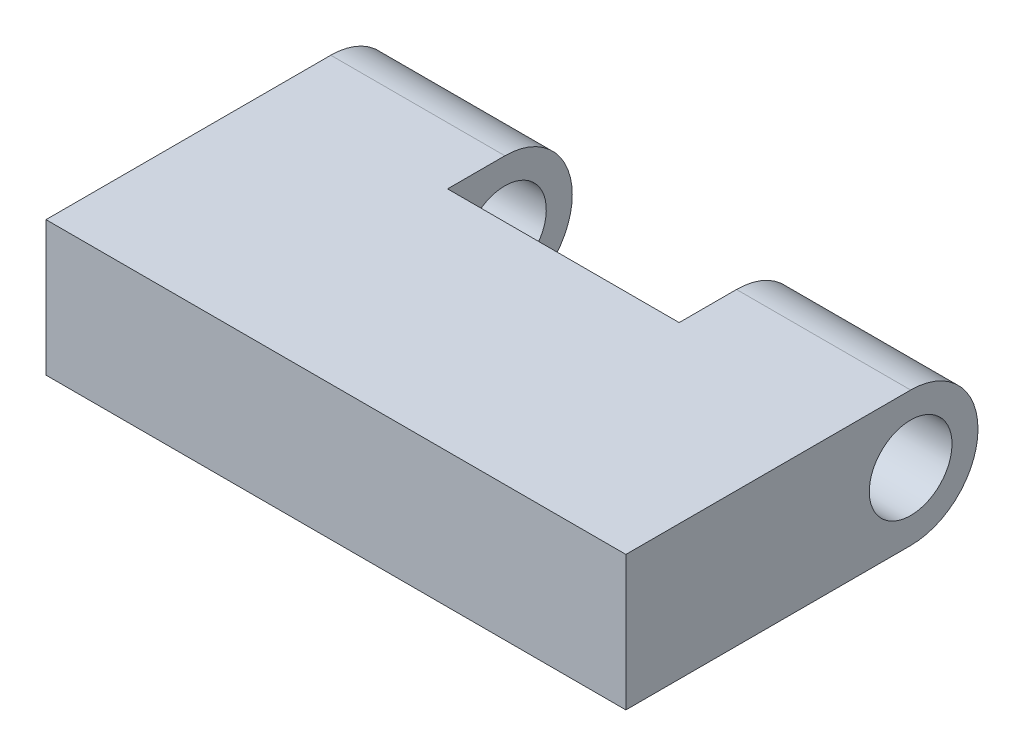
from build123d import *

# Parameters (mm, degrees)
SKETCH2_R           = 2.37553
BOSS_EXTRUDE1_DEPTH = 10
SKETCH3_W           = 13.058934706
SKETCH3_H           = 7.734398283
BOSS_EXTRUDE2_DEPTH = 13.2990488


with BuildPart() as part:
    # Sketch2 → Boss-Extrude1 (new body)
    with BuildSketch(Plane(origin=(6.059742926, 0, 0), x_dir=(0, 0, -1), z_dir=(1, 0, 0))):
        with BuildLine():
            Line((2.398599218, 21.444166214), (-3.368651258, 21.444166214))
            Line((-3.368651258, 21.444166214), (-13.95384316, 21.444166214))
            Line((-13.95384316, 21.444166214), (-13.95384316, 13.709767931))
            Line((-13.95384316, 13.709767931), (-3.368651258, 13.709767931))
            Line((-3.368651258, 13.709767931), (2.398599218, 13.709767931))
            ThreePointArc((2.398599218, 13.709767931), (6.26579836, 17.576967072), (2.398599218, 21.444166214))
        make_face()
        with Locations(Location((2.398599218, 17.576967072, 0), (0, 0, 90))):
            Circle(SKETCH2_R, mode=Mode.SUBTRACT)
    extrude(amount=BOSS_EXTRUDE1_DEPTH)


with BuildPart() as body_2:
    # Mirror2: mirrored copy
    add(part.part.mirror(Plane(origin=(-0.589781474, 0, 0), x_dir=(0, 0, 1), z_dir=(1, 0, 0))))


with BuildPart() as part_1:
    add(part.part)

    add(body_2.part)  # Boss-Extrude2 merges body 2
    # Sketch3 → Boss-Extrude2 (add)
    with BuildSketch(Plane.ZY.offset(-6.059742926)):
        with Locations((7.424375807, 17.576967073)):
            Rectangle(SKETCH3_W, SKETCH3_H)
    extrude(amount=BOSS_EXTRUDE2_DEPTH)


solid = part_1.part
